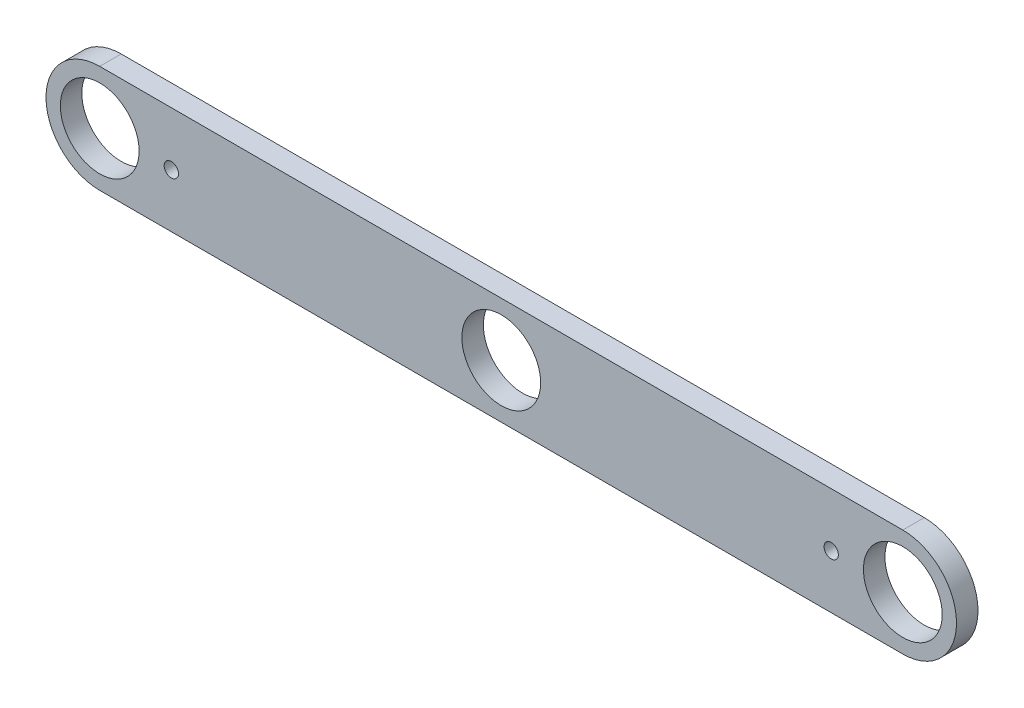
from build123d import *

# Parameters (mm, degrees)
SKETCH1_R           = 11
SKETCH1_R_2         = 2
BOSS_EXTRUDE1_DEPTH = 6


with BuildPart() as part:
    # Sketch1 → Boss-Extrude1 (new body)
    with BuildSketch(Plane.XY):
        with BuildLine():
            Line((112.155, -15), (-112.155, -15))
            ThreePointArc((-112.155, -15), (-127.155, 0), (-112.155, 15))
            Line((-112.155, 15), (112.155, 15))
            ThreePointArc((112.155, 15), (127.155, 0), (112.155, -15))
        make_face()
        Circle(SKETCH1_R, mode=Mode.SUBTRACT)
        with Locations((112.155, 0)):
            Circle(SKETCH1_R, mode=Mode.SUBTRACT)
        with Locations((-112.155, 0)):
            Circle(SKETCH1_R, mode=Mode.SUBTRACT)
        with Locations((-92.155, 0)):
            Circle(SKETCH1_R_2, mode=Mode.SUBTRACT)
        with Locations((92.155, 0)):
            Circle(SKETCH1_R_2, mode=Mode.SUBTRACT)
    extrude(amount=BOSS_EXTRUDE1_DEPTH)


solid = part.part
